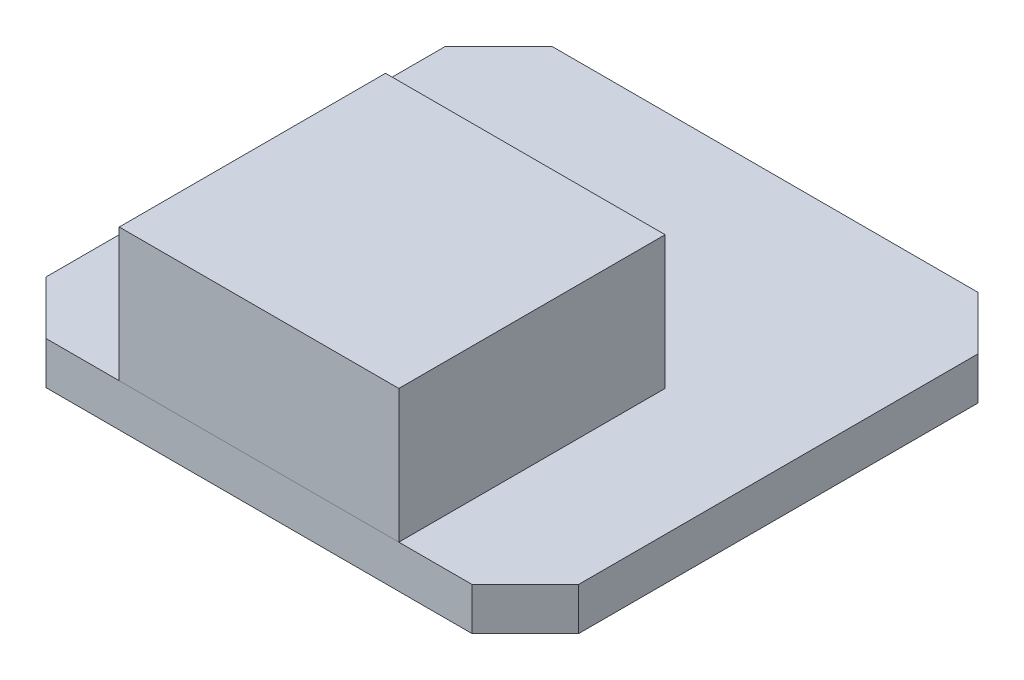
from build123d import *

# Parameters (mm, degrees)
SKETCH1_W           = 20
SKETCH1_H           = 19
BOSS_EXTRUDE1_DEPTH = 1.6
CHAMFER1_SIZE       = 2
SKETCH2_W           = 10.5
SKETCH2_H           = 10
BOSS_EXTRUDE2_DEPTH = 5


with BuildPart() as part:
    # Sketch1 → Boss-Extrude1 (new body)
    with BuildSketch(Plane(origin=(0, 0, 0), x_dir=(1, 0, 0), z_dir=(0, 1, 0))):
        with Locations((10, 9.5)):
            Rectangle(SKETCH1_W, SKETCH1_H)
    extrude(amount=BOSS_EXTRUDE1_DEPTH)

    # Chamfer1
    chamfer1_edges = [part.edges().sort_by_distance(p)[0] for p in [
        (0, 0.8, -19),
        (20, 0.8, -19),
        (20, 0.8, 0),
        (0, 0.8, 0),
    ]]
    chamfer(chamfer1_edges, length=CHAMFER1_SIZE)


with BuildPart() as body_2:
    # Sketch2 → Boss-Extrude2 (new body)
    with BuildSketch(Plane(origin=(0, 1.6, 0), x_dir=(1, 0, 0), z_dir=(0, 1, 0))):
        with Locations((10, 5)):
            Rectangle(SKETCH2_W, SKETCH2_H)
    extrude(amount=BOSS_EXTRUDE2_DEPTH)


solid = Compound([part.part, body_2.part])
